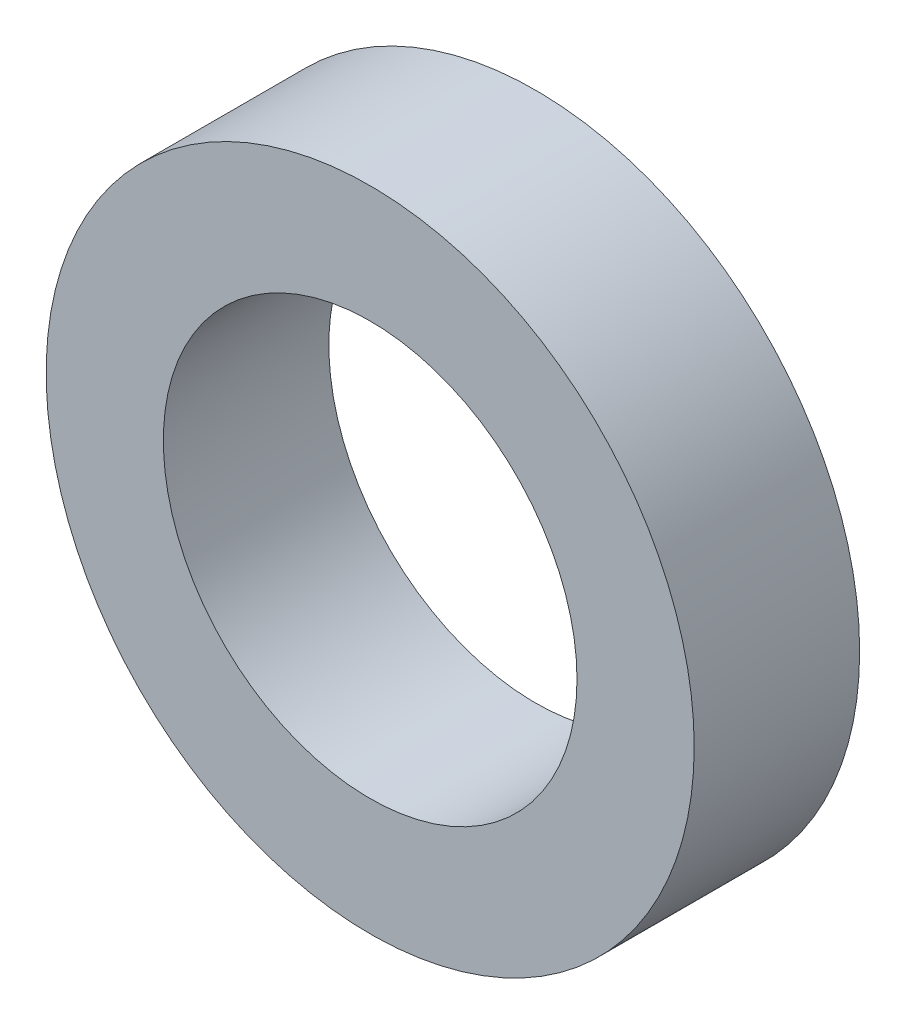
from build123d import *

# Parameters (mm, degrees)
SKETCH_1_R      = 23.5
SKETCH_1_R_2    = 15
EXTRUDE_1_DEPTH = 12


with BuildPart() as part:
    # 草图1 → 凸台-拉伸1 (new body)
    with BuildSketch(Plane.XY):
        Circle(SKETCH_1_R)
        Circle(SKETCH_1_R_2, mode=Mode.SUBTRACT)
    extrude(amount=EXTRUDE_1_DEPTH)


solid = part.part
